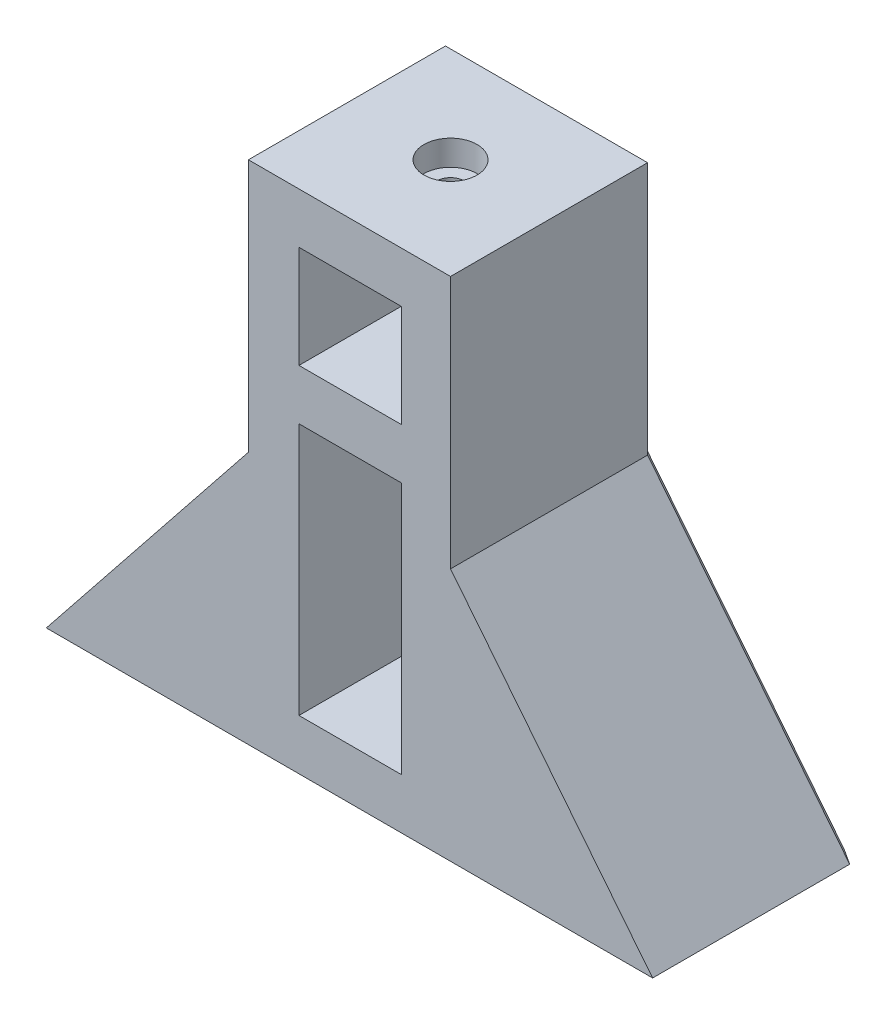
from build123d import *

# Parameters (mm, degrees)
SKETCH1_W           = 20.25
SKETCH1_H           = 20.25
SKETCH1_H_2         = 50
BOSS_EXTRUDE1_DEPTH = 40
CHAMFER1_SIZE       = 1
SKETCH2_R           = 2.75
CUT_EXTRUDE1_DEPTH  = 20
SKETCH3_R           = 5.25
CUT_EXTRUDE2_DEPTH  = 5


with BuildPart() as part:
    # Sketch1 → Boss-Extrude1 (new body)
    with BuildSketch(Plane.XY):
        Polygon((20, -19.875), (60, -70), (20, -70), (-20, -70), (-60, -70), (-20, -19.875), (-20, 30.25), (20, 30.25), align=None)
        with Locations((0.125, 10.125)):
            Rectangle(SKETCH1_W, SKETCH1_H, mode=Mode.SUBTRACT)
        with Locations((0.125, -35)):
            Rectangle(SKETCH1_W, SKETCH1_H_2, mode=Mode.SUBTRACT)
    extrude(amount=BOSS_EXTRUDE1_DEPTH)

    # Chamfer1
    chamfer1_edges = [part.edges().sort_by_distance(p)[0] for p in [
        (-40, -44.9375, 0),
        (-20, 5.1875, 0),
        (-10, 10.125, 0),
        (0.125, 0, 0),
        (10.25, 10.125, 0),
        (0.125, 20.25, 0),
        (-10, -35, 0),
        (0.125, -60, 0),
        (10.25, -35, 0),
        (0.125, -10, 0),
        (0, 30.25, 0),
        (20, 5.1875, 0),
        (40, -44.9375, 0),
        (0, -70, 0),
    ]]
    chamfer(chamfer1_edges, length=CHAMFER1_SIZE)

    # Sketch2 → Cut-Extrude1 (cut)
    with BuildSketch(Plane(origin=(0, 30.25, 0), x_dir=(1, 0, 0), z_dir=(0, 1, 0))):
        with Locations(Location((0, -20, 0), (0, 0, 180))):
            Circle(SKETCH2_R)
    extrude(amount=-CUT_EXTRUDE1_DEPTH, mode=Mode.SUBTRACT)

    # Sketch3 → Cut-Extrude2 (cut)
    with BuildSketch(Plane(origin=(0, 30.25, 0), x_dir=(1, 0, 0), z_dir=(0, 1, 0))):
        with Locations(Location((0, -20, 0), (0, 0, 180))):
            Circle(SKETCH3_R)
    extrude(amount=-CUT_EXTRUDE2_DEPTH, mode=Mode.SUBTRACT)


solid = part.part
